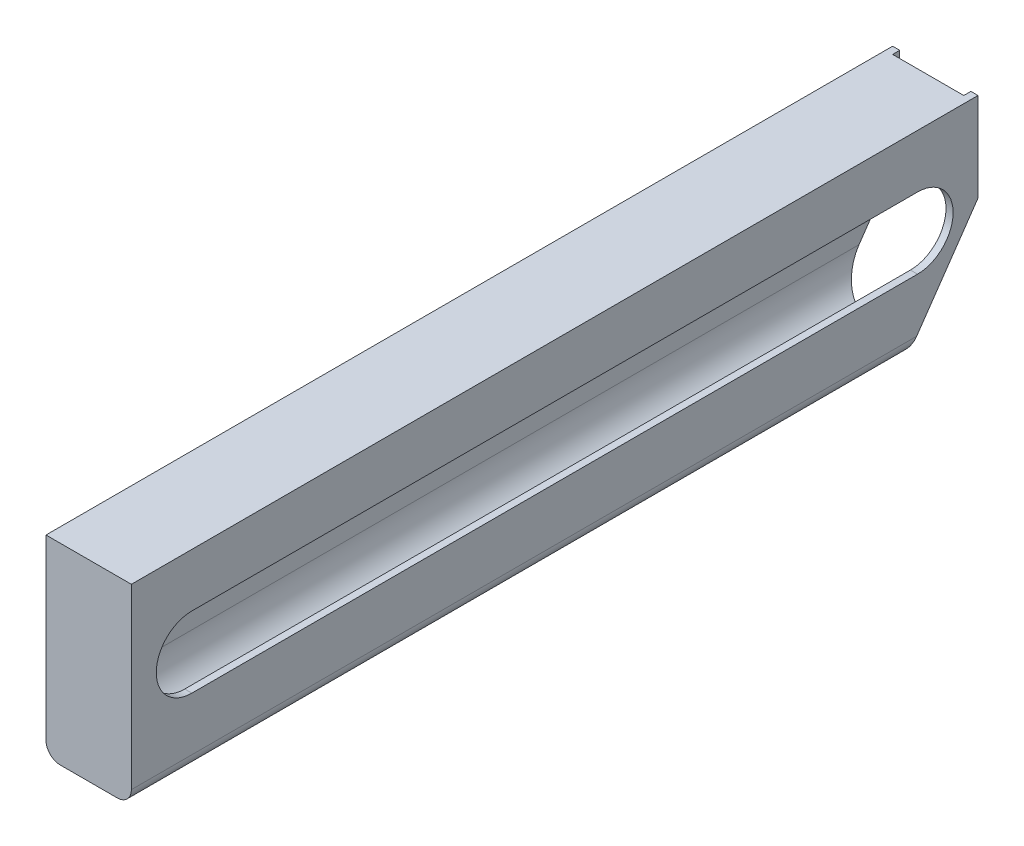
from build123d import *

# Parameters (mm, degrees)
BOSS_EXTRUDE1_DEPTH     = 119
CUT_EXTRUDE1_DEPTH      = 117
CUT_EXTRUDE2_DEPTH      = 121.479251326
SKETCH5_W               = 10
SKETCH5_H               = 2
CUT_EXTRUDE4_DEPTH      = 123.172009888
CUT_EXTRUDE5_DEPTH      = 121.030204532
CUT_EXTRUDE5_DEPTH_BACK = 121.030204532
SKETCH7_W               = 6
SKETCH7_H               = 2.5
BOSS_EXTRUDE2_DEPTH     = 2.5
SKETCH10_R              = 1
CUT_EXTRUDE6_DEPTH      = 6


with BuildPart() as part:
    # Sketch1 → Boss-Extrude1 (new body)
    with BuildSketch(Plane.XY):
        with BuildLine():
            Line((-6, 12.5), (6, 12.5))
            Line((6, 12.5), (6, -12.5))
            ThreePointArc((6, -12.5), (5.414213562, -13.914213562), (4, -14.5))
            Line((4, -14.5), (-4, -14.5))
            ThreePointArc((-4, -14.5), (-5.414213562, -13.914213562), (-6, -12.5))
            Line((-6, -12.5), (-6, 12.5))
        make_face()
    extrude(amount=BOSS_EXTRUDE1_DEPTH)

    # Sketch2 → Cut-Extrude1 (cut)
    with BuildSketch(Plane(origin=(0, 0, 0), x_dir=(-1, 0, 0), z_dir=(0, 0, -1))):
        with BuildLine():
            Line((-5, -8.3), (-5, 11.5))
            Line((-5, 11.5), (5, 11.5))
            Line((5, 11.5), (5, -8.3))
            ThreePointArc((5, -8.3), (0, -13.3), (-5, -8.3))
        make_face()
    extrude(amount=-CUT_EXTRUDE1_DEPTH, mode=Mode.SUBTRACT)

    # Sketch3 → Cut-Extrude2 (cut, through all)
    with BuildSketch(Plane(origin=(6, 0, 0), x_dir=(0, 0, -1), z_dir=(1, 0, 0))):
        with BuildLine():
            Line((-8.499997834, -5), (-110.499997834, -5))
            ThreePointArc((-110.499997834, -5), (-115.500002166, -2.166e-06), (-110.500002166, 5))
            Line((-110.500002166, 5), (-8.500002166, 5))
            ThreePointArc((-8.500002166, 5), (-3.500002166, 2.166e-06), (-8.499997834, -5))
        make_face()
    extrude(amount=-CUT_EXTRUDE2_DEPTH, mode=Mode.SUBTRACT)

    # Sketch5 → Cut-Extrude4 (cut, through all)
    with BuildSketch(Plane(origin=(0, 12.5, 0), x_dir=(1, 0, 0), z_dir=(0, 1, 0))):
        Rectangle(SKETCH5_W, SKETCH5_H)
    extrude(amount=-CUT_EXTRUDE4_DEPTH, mode=Mode.SUBTRACT)

    # Sketch6 → Cut-Extrude5 (cut, two sides: drawn at the far end of the back side and taken through both)
    with BuildSketch(Plane(origin=(0, 0, 0), x_dir=(0, 0, -1), z_dir=(1, 0, 0)).offset(-CUT_EXTRUDE5_DEPTH_BACK)):
        Polygon((0, 0), (-10, -14.5), (0, -14.5), align=None)
    extrude(amount=CUT_EXTRUDE5_DEPTH + CUT_EXTRUDE5_DEPTH_BACK, mode=Mode.SUBTRACT)

    # Sketch7 → Boss-Extrude2 (add)
    with BuildSketch(Plane(origin=(0, 0, 117), x_dir=(-1, 0, 0), z_dir=(0, 0, -1))):
        with Locations((0, -11)):
            Rectangle(SKETCH7_W, SKETCH7_H)
    extrude(amount=BOSS_EXTRUDE2_DEPTH)

    # Sketch10 → Cut-Extrude6 (cut)
    with BuildSketch(Plane.ZY.offset(3)):
        with Locations((115.75, -11)):
            Circle(SKETCH10_R)
    extrude(amount=-CUT_EXTRUDE6_DEPTH, mode=Mode.SUBTRACT)


solid = part.part
